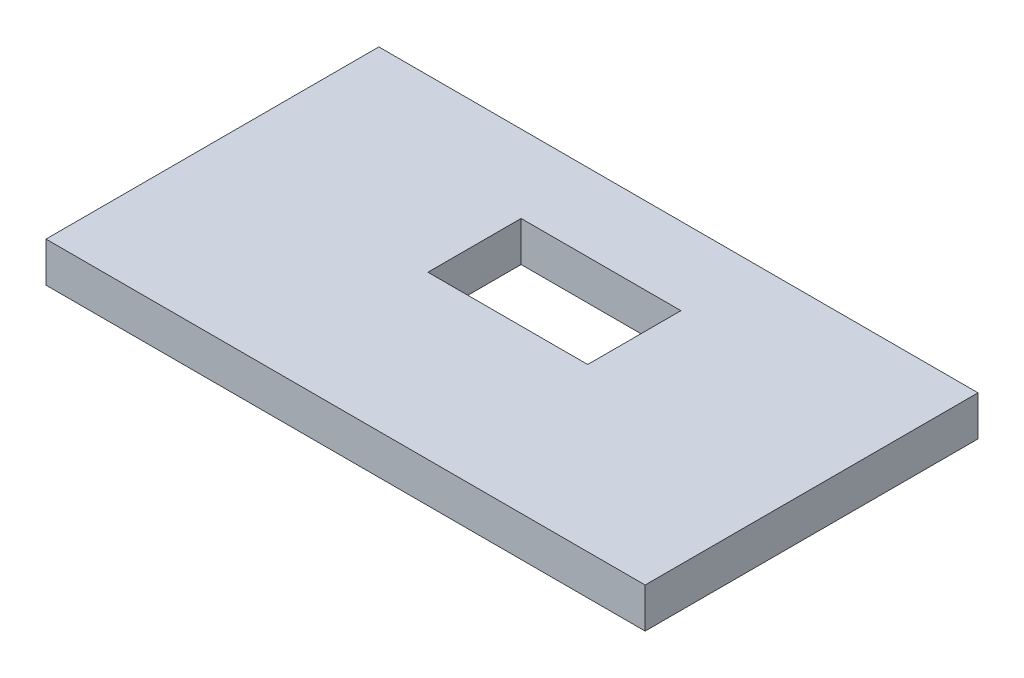
from build123d import *

# Parameters (mm, degrees)
SKETCH1_W           = 45
SKETCH1_H           = 25
BOSS_EXTRUDE1_DEPTH = 3
SKETCH2_W           = 12
SKETCH2_H           = 7
CUT_EXTRUDE1_DEPTH  = 3


with BuildPart() as part:
    # Sketch1 → Boss-Extrude1 (new body)
    with BuildSketch(Plane(origin=(0, 0, 0), x_dir=(1, 0, 0), z_dir=(0, 1, 0))):
        with Locations((22.5, 12.5)):
            Rectangle(SKETCH1_W, SKETCH1_H)
    extrude(amount=BOSS_EXTRUDE1_DEPTH)

    # Sketch2 → Cut-Extrude1 (cut)
    with BuildSketch(Plane.XZ):
        with Locations((22.5, -15.684819353)):
            Rectangle(SKETCH2_W, SKETCH2_H)
    extrude(amount=-CUT_EXTRUDE1_DEPTH, mode=Mode.SUBTRACT)


solid = part.part
